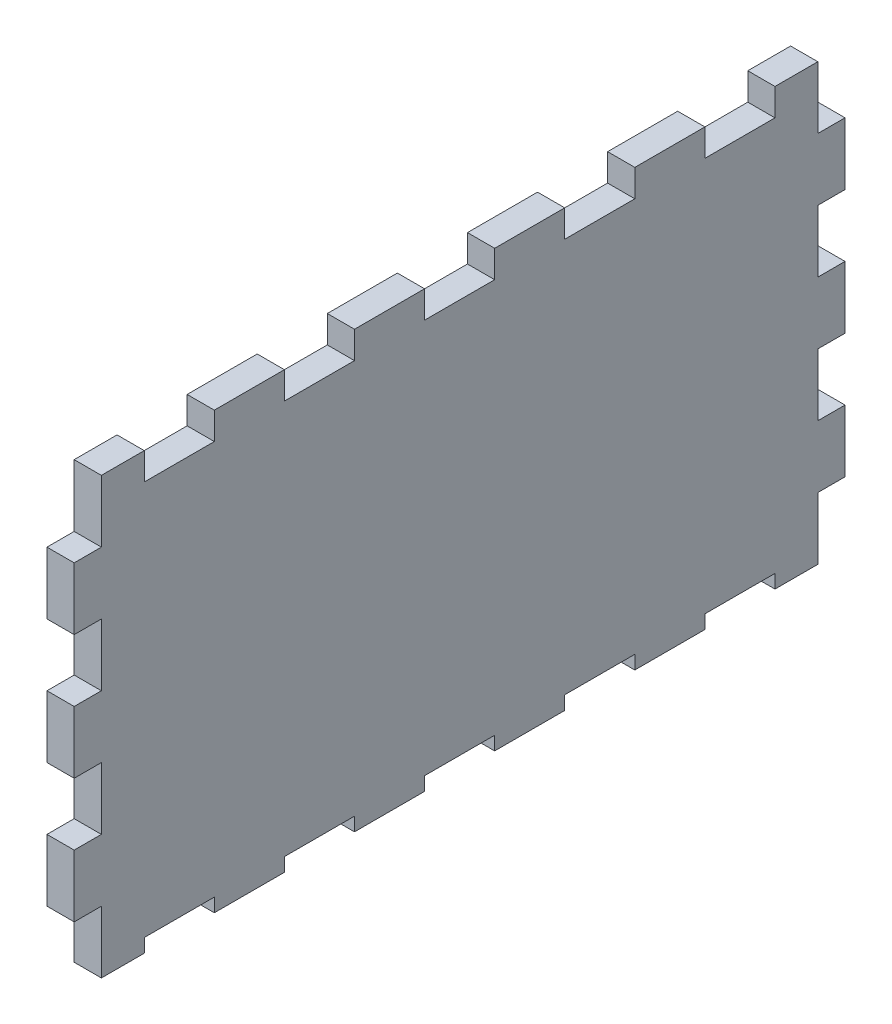
from build123d import *

# Parameters (mm, degrees)
ESBO_O1_W                = 170
ESBO_O1_H                = 96
RESSALTO_EXTRUS_O1_DEPTH = 6
CORTE_EXTRUS_O1_REACH    = 99.801
ESBO_O2_W                = 15.455454545
ESBO_O2_H                = 6
CORTE_EXTRUS_O2_REACH    = 99.801
ESBO_O3_W                = 6
ESBO_O3_H                = 13.714285714


with BuildPart() as part:
    # Esboço1 → Ressalto-extrusão1 (new body)
    with BuildSketch(Plane(origin=(0, 0, 0), x_dir=(0, 0, -1), z_dir=(1, 0, 0))):
        Rectangle(ESBO_O1_W, ESBO_O1_H)
    extrude(amount=RESSALTO_EXTRUS_O1_DEPTH)

    # Esboço2 → Corte-extrusão1 (cut, up to next)
    with BuildSketch(Plane(origin=(6, 0, 0), x_dir=(0, 0, -1), z_dir=(1, 0, 0)), mode=Mode.PRIVATE) as corte_extrus_o1_sk1:
        with Locations((0.002272727, 45)):
            Rectangle(ESBO_O2_W, ESBO_O2_H)
    corte_extrus_o1_tool1 = extrude(corte_extrus_o1_sk1.sketch, amount=-CORTE_EXTRUS_O1_REACH, mode=Mode.PRIVATE) & part.part
    # Esboço2 → Corte-extrusão1 (cut, up to next)
    with BuildSketch(Plane(origin=(6, 0, 0), x_dir=(0, 0, -1), z_dir=(1, 0, 0)), mode=Mode.PRIVATE) as corte_extrus_o1_sk2:
        with Locations((-30.907727273, 45)):
            Rectangle(ESBO_O2_W, ESBO_O2_H)
    corte_extrus_o1_tool2 = extrude(corte_extrus_o1_sk2.sketch, amount=-CORTE_EXTRUS_O1_REACH, mode=Mode.PRIVATE) & part.part
    # Esboço2 → Corte-extrusão1 (cut, up to next)
    with BuildSketch(Plane(origin=(6, 0, 0), x_dir=(0, 0, -1), z_dir=(1, 0, 0)), mode=Mode.PRIVATE) as corte_extrus_o1_sk3:
        with Locations((-61.817727273, 45)):
            Rectangle(ESBO_O2_W, ESBO_O2_H)
    corte_extrus_o1_tool3 = extrude(corte_extrus_o1_sk3.sketch, amount=-CORTE_EXTRUS_O1_REACH, mode=Mode.PRIVATE) & part.part
    # Esboço2 → Corte-extrusão1 (cut, up to next)
    with BuildSketch(Plane(origin=(6, 0, 0), x_dir=(0, 0, -1), z_dir=(1, 0, 0)), mode=Mode.PRIVATE) as corte_extrus_o1_sk4:
        with Locations((30.912272728, 45)):
            Rectangle(ESBO_O2_W, ESBO_O2_H)
    corte_extrus_o1_tool4 = extrude(corte_extrus_o1_sk4.sketch, amount=-CORTE_EXTRUS_O1_REACH, mode=Mode.PRIVATE) & part.part
    # Esboço2 → Corte-extrusão1 (cut, up to next)
    with BuildSketch(Plane(origin=(6, 0, 0), x_dir=(0, 0, -1), z_dir=(1, 0, 0)), mode=Mode.PRIVATE) as corte_extrus_o1_sk5:
        with Locations((61.822272728, 45)):
            Rectangle(ESBO_O2_W, ESBO_O2_H)
    corte_extrus_o1_tool5 = extrude(corte_extrus_o1_sk5.sketch, amount=-CORTE_EXTRUS_O1_REACH, mode=Mode.PRIVATE) & part.part
    # Esboço2 → Corte-extrusão1 (cut, up to next)
    with BuildSketch(Plane(origin=(6, 0, 0), x_dir=(0, 0, -1), z_dir=(1, 0, 0)), mode=Mode.PRIVATE) as corte_extrus_o1_sk6:
        with Locations((-61.817727273, -48)):
            Rectangle(ESBO_O2_W, ESBO_O2_H)
    corte_extrus_o1_tool6 = extrude(corte_extrus_o1_sk6.sketch, amount=-CORTE_EXTRUS_O1_REACH, mode=Mode.PRIVATE) & part.part
    # Esboço2 → Corte-extrusão1 (cut, up to next)
    with BuildSketch(Plane(origin=(6, 0, 0), x_dir=(0, 0, -1), z_dir=(1, 0, 0)), mode=Mode.PRIVATE) as corte_extrus_o1_sk7:
        with Locations((-30.907727273, -48)):
            Rectangle(ESBO_O2_W, ESBO_O2_H)
    corte_extrus_o1_tool7 = extrude(corte_extrus_o1_sk7.sketch, amount=-CORTE_EXTRUS_O1_REACH, mode=Mode.PRIVATE) & part.part
    # Esboço2 → Corte-extrusão1 (cut, up to next)
    with BuildSketch(Plane(origin=(6, 0, 0), x_dir=(0, 0, -1), z_dir=(1, 0, 0)), mode=Mode.PRIVATE) as corte_extrus_o1_sk8:
        with Locations((0.002272727, -48)):
            Rectangle(ESBO_O2_W, ESBO_O2_H)
    corte_extrus_o1_tool8 = extrude(corte_extrus_o1_sk8.sketch, amount=-CORTE_EXTRUS_O1_REACH, mode=Mode.PRIVATE) & part.part
    # Esboço2 → Corte-extrusão1 (cut, up to next)
    with BuildSketch(Plane(origin=(6, 0, 0), x_dir=(0, 0, -1), z_dir=(1, 0, 0)), mode=Mode.PRIVATE) as corte_extrus_o1_sk9:
        with Locations((30.912272728, -48)):
            Rectangle(ESBO_O2_W, ESBO_O2_H)
    corte_extrus_o1_tool9 = extrude(corte_extrus_o1_sk9.sketch, amount=-CORTE_EXTRUS_O1_REACH, mode=Mode.PRIVATE) & part.part
    # Esboço2 → Corte-extrusão1 (cut, up to next)
    with BuildSketch(Plane(origin=(6, 0, 0), x_dir=(0, 0, -1), z_dir=(1, 0, 0)), mode=Mode.PRIVATE) as corte_extrus_o1_sk10:
        with Locations((61.822272728, -48)):
            Rectangle(ESBO_O2_W, ESBO_O2_H)
    corte_extrus_o1_tool10 = extrude(corte_extrus_o1_sk10.sketch, amount=-CORTE_EXTRUS_O1_REACH, mode=Mode.PRIVATE) & part.part
    add(corte_extrus_o1_tool1.solids().sort_by_distance((6, 45, -0.002273))[0], mode=Mode.SUBTRACT)
    add(corte_extrus_o1_tool2.solids().sort_by_distance((6, 45, 30.907727))[0], mode=Mode.SUBTRACT)
    add(corte_extrus_o1_tool3.solids().sort_by_distance((6, 45, 61.817727))[0], mode=Mode.SUBTRACT)
    add(corte_extrus_o1_tool4.solids().sort_by_distance((6, 45, -30.912273))[0], mode=Mode.SUBTRACT)
    add(corte_extrus_o1_tool5.solids().sort_by_distance((6, 45, -61.822273))[0], mode=Mode.SUBTRACT)
    add(corte_extrus_o1_tool6.solids().sort_by_distance((6, -48, 61.817727))[0], mode=Mode.SUBTRACT)
    add(corte_extrus_o1_tool7.solids().sort_by_distance((6, -48, 30.907727))[0], mode=Mode.SUBTRACT)
    add(corte_extrus_o1_tool8.solids().sort_by_distance((6, -48, -0.002273))[0], mode=Mode.SUBTRACT)
    add(corte_extrus_o1_tool9.solids().sort_by_distance((6, -48, -30.912273))[0], mode=Mode.SUBTRACT)
    add(corte_extrus_o1_tool10.solids().sort_by_distance((6, -48, -61.822273))[0], mode=Mode.SUBTRACT)

    # Esboço3 → Corte-extrusão2 (cut, up to next)
    with BuildSketch(Plane(origin=(6, 0, 0), x_dir=(0, 0, -1), z_dir=(1, 0, 0)), mode=Mode.PRIVATE) as corte_extrus_o2_sk1:
        with Locations((82, -41.142857143)):
            Rectangle(ESBO_O3_W, ESBO_O3_H)
    corte_extrus_o2_tool1 = extrude(corte_extrus_o2_sk1.sketch, amount=-CORTE_EXTRUS_O2_REACH, mode=Mode.PRIVATE) & part.part
    # Esboço3 → Corte-extrusão2 (cut, up to next)
    with BuildSketch(Plane(origin=(6, 0, 0), x_dir=(0, 0, -1), z_dir=(1, 0, 0)), mode=Mode.PRIVATE) as corte_extrus_o2_sk2:
        with Locations((-82, -41.142857143)):
            Rectangle(ESBO_O3_W, ESBO_O3_H)
    corte_extrus_o2_tool2 = extrude(corte_extrus_o2_sk2.sketch, amount=-CORTE_EXTRUS_O2_REACH, mode=Mode.PRIVATE) & part.part
    # Esboço3 → Corte-extrusão2 (cut, up to next)
    with BuildSketch(Plane(origin=(6, 0, 0), x_dir=(0, 0, -1), z_dir=(1, 0, 0)), mode=Mode.PRIVATE) as corte_extrus_o2_sk3:
        with Locations((82, -13.712857143)):
            Rectangle(ESBO_O3_W, ESBO_O3_H)
    corte_extrus_o2_tool3 = extrude(corte_extrus_o2_sk3.sketch, amount=-CORTE_EXTRUS_O2_REACH, mode=Mode.PRIVATE) & part.part
    # Esboço3 → Corte-extrusão2 (cut, up to next)
    with BuildSketch(Plane(origin=(6, 0, 0), x_dir=(0, 0, -1), z_dir=(1, 0, 0)), mode=Mode.PRIVATE) as corte_extrus_o2_sk4:
        with Locations((82, 13.717142857)):
            Rectangle(ESBO_O3_W, ESBO_O3_H)
    corte_extrus_o2_tool4 = extrude(corte_extrus_o2_sk4.sketch, amount=-CORTE_EXTRUS_O2_REACH, mode=Mode.PRIVATE) & part.part
    # Esboço3 → Corte-extrusão2 (cut, up to next)
    with BuildSketch(Plane(origin=(6, 0, 0), x_dir=(0, 0, -1), z_dir=(1, 0, 0)), mode=Mode.PRIVATE) as corte_extrus_o2_sk5:
        with Locations((82, 41.147142857)):
            Rectangle(ESBO_O3_W, ESBO_O3_H)
    corte_extrus_o2_tool5 = extrude(corte_extrus_o2_sk5.sketch, amount=-CORTE_EXTRUS_O2_REACH, mode=Mode.PRIVATE) & part.part
    # Esboço3 → Corte-extrusão2 (cut, up to next)
    with BuildSketch(Plane(origin=(6, 0, 0), x_dir=(0, 0, -1), z_dir=(1, 0, 0)), mode=Mode.PRIVATE) as corte_extrus_o2_sk6:
        with Locations((-82, -13.712857143)):
            Rectangle(ESBO_O3_W, ESBO_O3_H)
    corte_extrus_o2_tool6 = extrude(corte_extrus_o2_sk6.sketch, amount=-CORTE_EXTRUS_O2_REACH, mode=Mode.PRIVATE) & part.part
    # Esboço3 → Corte-extrusão2 (cut, up to next)
    with BuildSketch(Plane(origin=(6, 0, 0), x_dir=(0, 0, -1), z_dir=(1, 0, 0)), mode=Mode.PRIVATE) as corte_extrus_o2_sk7:
        with Locations((-82, 13.717142857)):
            Rectangle(ESBO_O3_W, ESBO_O3_H)
    corte_extrus_o2_tool7 = extrude(corte_extrus_o2_sk7.sketch, amount=-CORTE_EXTRUS_O2_REACH, mode=Mode.PRIVATE) & part.part
    # Esboço3 → Corte-extrusão2 (cut, up to next)
    with BuildSketch(Plane(origin=(6, 0, 0), x_dir=(0, 0, -1), z_dir=(1, 0, 0)), mode=Mode.PRIVATE) as corte_extrus_o2_sk8:
        with Locations((-82, 41.147142857)):
            Rectangle(ESBO_O3_W, ESBO_O3_H)
    corte_extrus_o2_tool8 = extrude(corte_extrus_o2_sk8.sketch, amount=-CORTE_EXTRUS_O2_REACH, mode=Mode.PRIVATE) & part.part
    add(corte_extrus_o2_tool1.solids().sort_by_distance((6, -41.142857, -82))[0], mode=Mode.SUBTRACT)
    add(corte_extrus_o2_tool2.solids().sort_by_distance((6, -41.142857, 82))[0], mode=Mode.SUBTRACT)
    add(corte_extrus_o2_tool3.solids().sort_by_distance((6, -13.712857, -82))[0], mode=Mode.SUBTRACT)
    add(corte_extrus_o2_tool4.solids().sort_by_distance((6, 13.717143, -82))[0], mode=Mode.SUBTRACT)
    add(corte_extrus_o2_tool5.solids().sort_by_distance((6, 41.147143, -82))[0], mode=Mode.SUBTRACT)
    add(corte_extrus_o2_tool6.solids().sort_by_distance((6, -13.712857, 82))[0], mode=Mode.SUBTRACT)
    add(corte_extrus_o2_tool7.solids().sort_by_distance((6, 13.717143, 82))[0], mode=Mode.SUBTRACT)
    add(corte_extrus_o2_tool8.solids().sort_by_distance((6, 41.147143, 82))[0], mode=Mode.SUBTRACT)


solid = part.part
